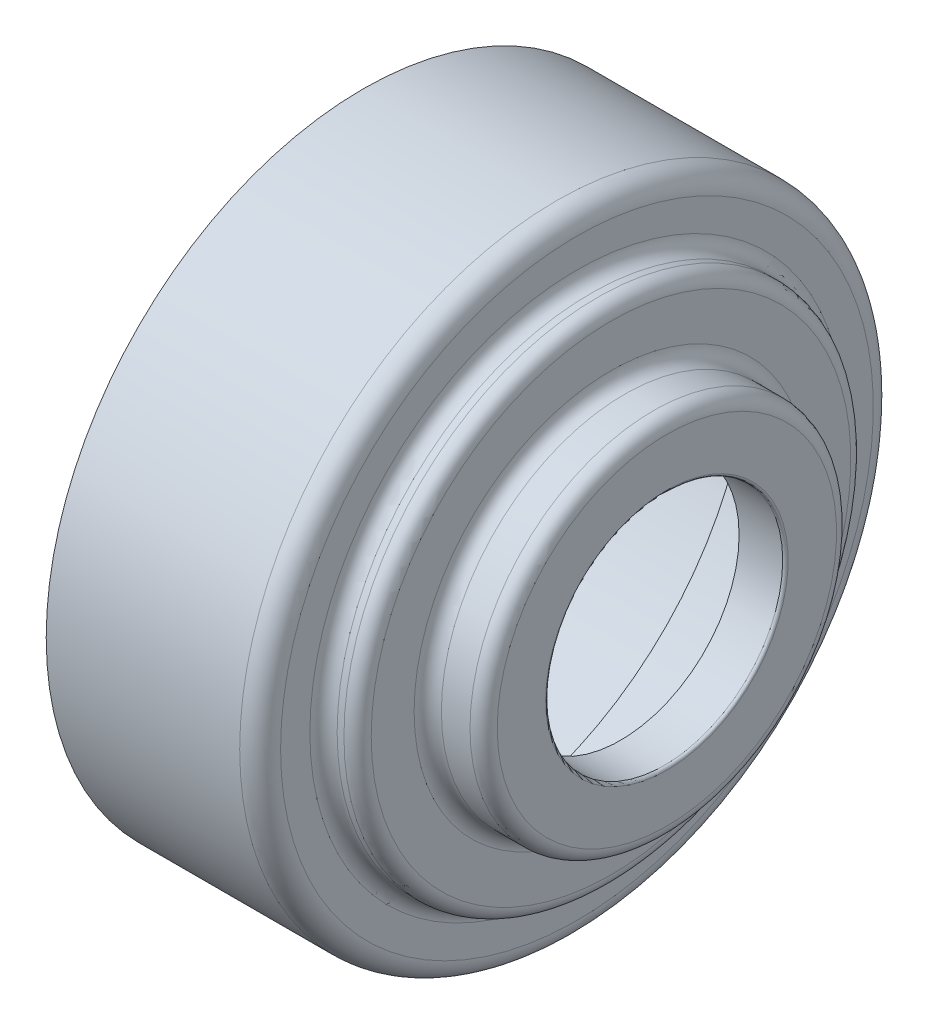
from build123d import *

# Parameters (mm, degrees)
FILLET_1_R = 0.2
FILLET_2_R = 1
FILLET_3_R = 1.5


with BuildPart() as part:
    # 草图2 → 旋转1 (revolve)
    with BuildSketch(Plane.XY, mode=Mode.PRIVATE) as revolve_1_sk:
        Polygon((-14.5, 22), (-7.5, 22), (-7.5, 21.4), (0, 21.4), (0, 17.4), (2.5, 17.4), (2.5, 12.25), (6.6, 12.25), (6.6, 9.4), (4.4, 9.4), (4.4, 8.7), (7.8, 8.7), (7.8, 13.45), (3.7, 13.45), (3.7, 18.6), (1.2, 18.6), (1.2, 23.25), (-14.5, 23.25), align=None)
    revolve(revolve_1_sk.sketch.rotate(Axis((-36.936605317, 0, 0), (1, 0, 0)), 90), axis=Axis((-36.936605317, 0, 0), (1, 0, 0)))

    # 圆角1
    fillet_1_edges = [part.edges().sort_by_distance(p)[0] for p in [
        (0, 0, -21.4),
        (0, 0, -17.4),
        (2.5, 0, -17.4),
        (6.6, 0, -12.25),
        (7.8, 0, -8.7),
    ]]
    fillet(fillet_1_edges, radius=FILLET_1_R)

    # 圆角2
    fillet_2_edges = [part.edges().sort_by_distance(p)[0] for p in [
        (7.8, 0, -13.45),
        (3.7, 0, -13.45),
        (3.7, 0, -18.6),
        (1.2, 0, -18.6),
    ]]
    fillet(fillet_2_edges, radius=FILLET_2_R)

    # 圆角3
    fillet_3_edges = [part.edges().sort_by_distance(p)[0] for p in [
        (2.5, 0, -12.25),
        (1.2, 0, -23.25),
    ]]
    fillet(fillet_3_edges, radius=FILLET_3_R)


solid = part.part
